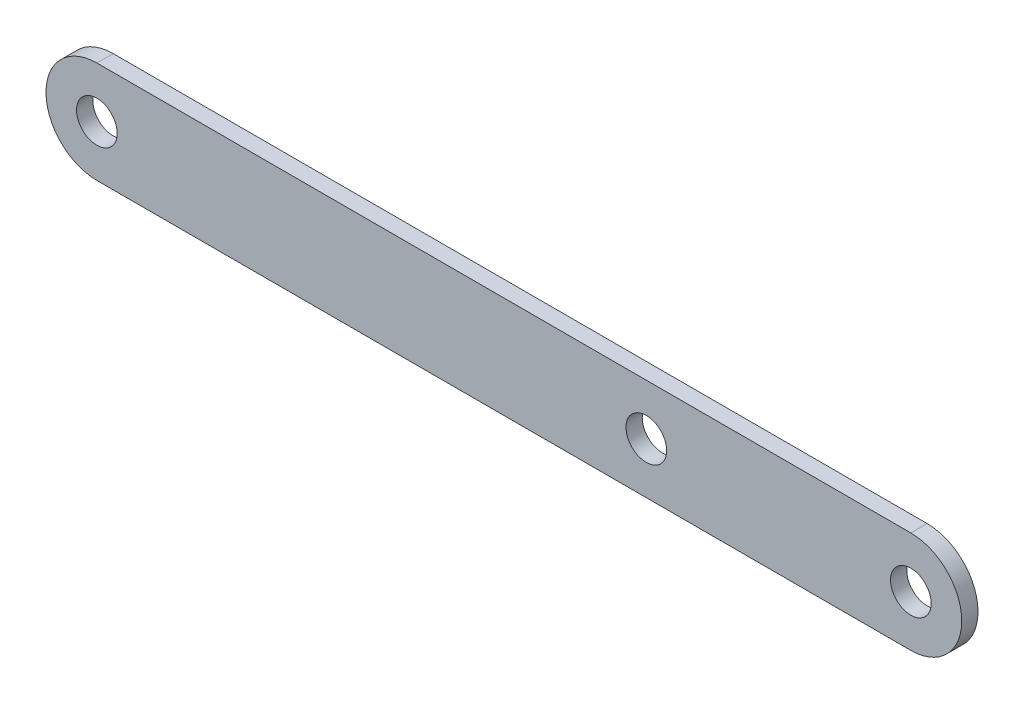
from build123d import *

# Parameters (mm, degrees)
BOSS_EXTRU_1_DEPTH      = 4
ESQUISSE2_R             = 10
ENL_V_MAT_EXTRU_1_DEPTH = 227.525936705
ESQUISSE3_R             = 10
ENL_V_MAT_EXTRU_2_DEPTH = 227.525936705


with BuildPart() as part:
    # Esquisse1 → Boss.-Extru.1 (new, symmetric)
    with BuildSketch(Plane.XY):
        with BuildLine():
            Line((-200, 25), (200, 25))
            ThreePointArc((200, 25), (225, 0), (200, -25))
            Line((200, -25), (-200, -25))
            ThreePointArc((-200, -25), (-225, 0), (-200, 25))
        make_face()
    extrude(amount=BOSS_EXTRU_1_DEPTH, both=True)

    # Esquisse2 → Enlèv. mat.-Extru.1 (cut, through all)
    with BuildSketch(Plane.XY.offset(4)):
        with Locations((-200, 0)):
            Circle(ESQUISSE2_R)
        with Locations((200, 0)):
            Circle(ESQUISSE2_R)
    extrude(amount=-ENL_V_MAT_EXTRU_1_DEPTH, mode=Mode.SUBTRACT)

    # Esquisse3 → Enlèv. mat.-Extru.2 (cut, through all)
    with BuildSketch(Plane(origin=(0, 0, -4), x_dir=(-1, 0, 0), z_dir=(0, 0, -1))):
        with Locations((-70, 0)):
            Circle(ESQUISSE3_R)
    extrude(amount=-ENL_V_MAT_EXTRU_2_DEPTH, mode=Mode.SUBTRACT)


solid = part.part
